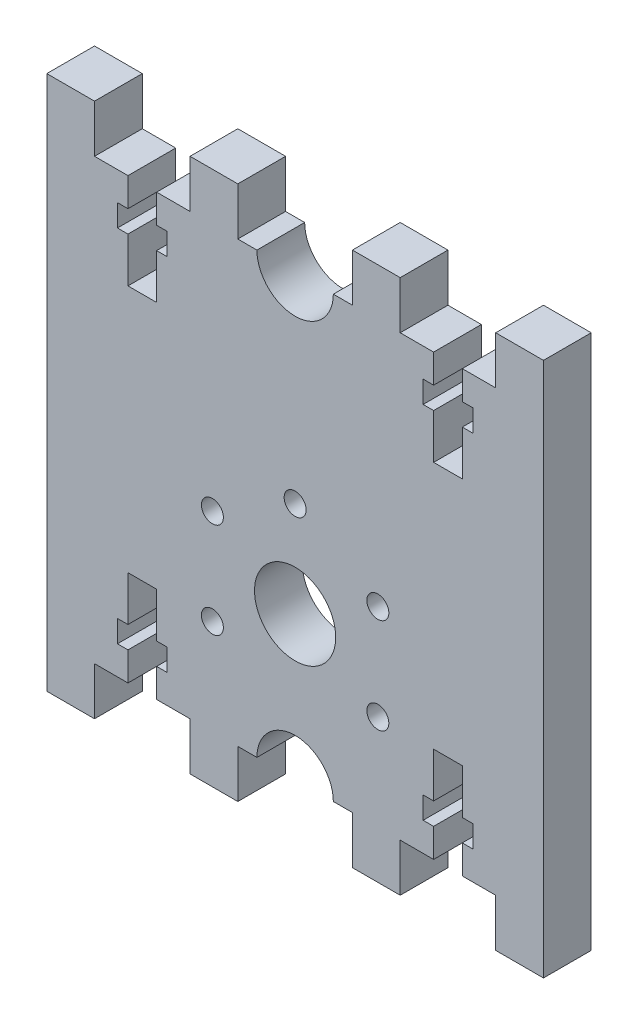
from build123d import *

# Parameters (mm, degrees)
SKETCH1_R           = 4.25
SKETCH1_R_2         = 1.15
BOSS_EXTRUDE1_DEPTH = 5


with BuildPart() as part:
    # Sketch1 → Boss-Extrude1 (new body)
    with BuildSketch(Plane.XY):
        with BuildLine():
            Line((11.5, 46), (15, 46))
            Line((15, 46), (15, 51))
            Line((15, 51), (20, 51))
            Line((20, 51), (20, 46))
            Line((20, 46), (22, 46))
            ThreePointArc((22, 46), (26, 42), (30, 46))
            Line((30, 46), (32, 46))
            Line((32, 46), (32, 51))
            Line((32, 51), (37, 51))
            Line((37, 51), (37, 46))
            Line((37, 46), (40.5, 46))
            Line((40.5, 46), (40.5, 43))
            Line((40.5, 43), (39.4, 43))
            Line((39.4, 43), (39.4, 40.7))
            Line((39.4, 40.7), (40.5, 40.7))
            Line((40.5, 40.7), (40.5, 36))
            Line((40.5, 36), (43.5, 36))
            Line((43.5, 36), (43.5, 40.7))
            Line((43.5, 40.7), (44.6, 40.7))
            Line((44.6, 40.7), (44.6, 43))
            Line((44.6, 43), (43.5, 43))
            Line((43.5, 43), (43.5, 46))
            Line((43.5, 46), (47, 46))
            Line((47, 46), (47, 51))
            Line((47, 51), (52, 51))
            Line((52, 51), (52, 0))
            Line((52, 0), (52, -5))
            Line((52, -5), (47, -5))
            Line((47, -5), (47, 0))
            Line((47, 0), (43.5, 0))
            Line((43.5, 0), (43.5, 3))
            Line((43.5, 3), (44.6, 3))
            Line((44.6, 3), (44.6, 5.3))
            Line((44.6, 5.3), (43.5, 5.3))
            Line((43.5, 5.3), (43.5, 10))
            Line((43.5, 10), (40.5, 10))
            Line((40.5, 10), (40.5, 5.3))
            Line((40.5, 5.3), (39.4, 5.3))
            Line((39.4, 5.3), (39.4, 3))
            Line((39.4, 3), (40.5, 3))
            Line((40.5, 3), (40.5, 0))
            Line((40.5, 0), (37, 0))
            Line((37, 0), (37, -5))
            Line((37, -5), (32, -5))
            Line((32, -5), (32, 0))
            Line((32, 0), (30, 0))
            ThreePointArc((30, 0), (26, 4), (22, 0))
            Line((22, 0), (20, 0))
            Line((20, 0), (20, -5))
            Line((20, -5), (15, -5))
            Line((15, -5), (15, 0))
            Line((15, 0), (11.5, 0))
            Line((11.5, 0), (11.5, 3))
            Line((11.5, 3), (12.6, 3))
            Line((12.6, 3), (12.6, 5.3))
            Line((12.6, 5.3), (11.5, 5.3))
            Line((11.5, 5.3), (11.5, 10))
            Line((11.5, 10), (8.5, 10))
            Line((8.5, 10), (8.5, 5.3))
            Line((8.5, 5.3), (7.4, 5.3))
            Line((7.4, 5.3), (7.4, 3))
            Line((7.4, 3), (8.5, 3))
            Line((8.5, 3), (8.5, 0))
            Line((8.5, 0), (5, 0))
            Line((5, 0), (5, -5))
            Line((5, -5), (0, -5))
            Line((0, -5), (0, 0))
            Line((0, 0), (0, 51))
            Line((0, 51), (5, 51))
            Line((5, 51), (5, 46))
            Line((5, 46), (8.5, 46))
            Line((8.5, 46), (8.5, 43))
            Line((8.5, 43), (7.4, 43))
            Line((7.4, 43), (7.4, 40.7))
            Line((7.4, 40.7), (8.5, 40.7))
            Line((8.5, 40.7), (8.5, 36))
            Line((8.5, 36), (11.5, 36))
            Line((11.5, 36), (11.5, 40.7))
            Line((11.5, 40.7), (12.6, 40.7))
            Line((12.6, 40.7), (12.6, 43))
            Line((12.6, 43), (11.5, 43))
            Line((11.5, 43), (11.5, 46))
        make_face()
        with Locations((26, 15)):
            Circle(SKETCH1_R, mode=Mode.SUBTRACT)
        with Locations((26, 25)):
            Circle(SKETCH1_R_2, mode=Mode.SUBTRACT)
        with Locations((34.660254038, 20)):
            Circle(SKETCH1_R_2, mode=Mode.SUBTRACT)
        with Locations((34.660254038, 10)):
            Circle(SKETCH1_R_2, mode=Mode.SUBTRACT)
        with Locations((17.339745962, 10)):
            Circle(SKETCH1_R_2, mode=Mode.SUBTRACT)
        with Locations((17.339745962, 20)):
            Circle(SKETCH1_R_2, mode=Mode.SUBTRACT)
    extrude(amount=BOSS_EXTRUDE1_DEPTH)


solid = part.part
